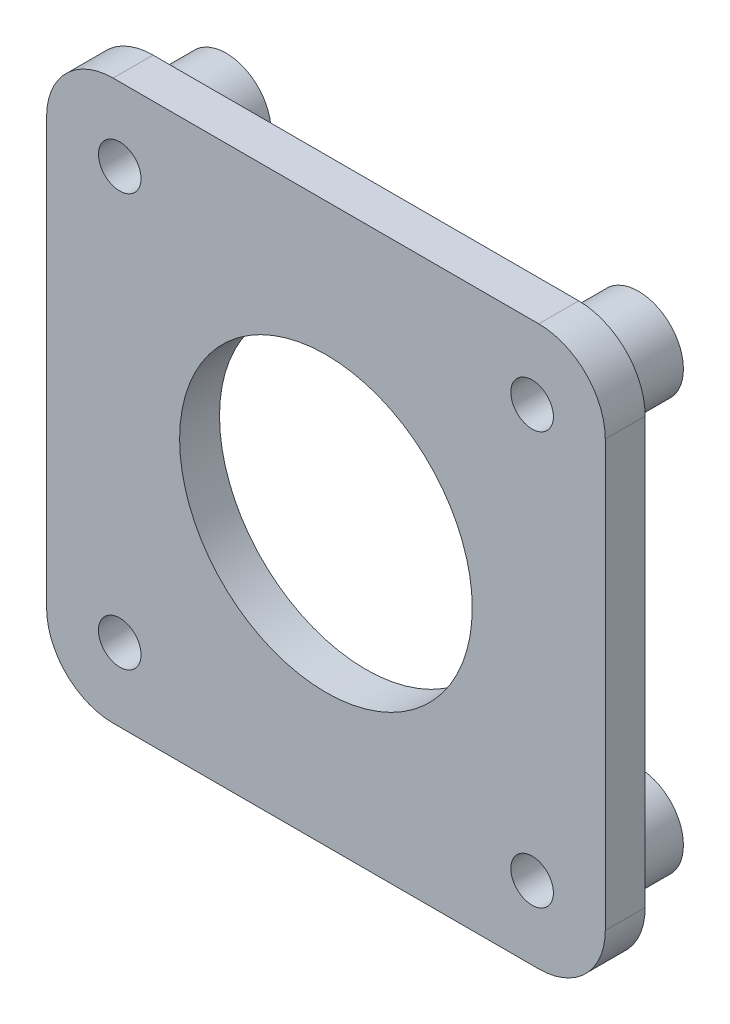
from build123d import *
from build123d.topology import SkipClean

# Parameters (mm, degrees)
SKETCH_1_W          = 42
SKETCH_1_H          = 42
SKETCH_1_R          = 1.6
SKETCH_1_R_2        = 11
EXTRUDE_1_DEPTH     = 3
FILLET_1_R          = 5
SKETCH_2_R          = 18
SKETCH_2_R_2        = 16
EXTRUDE_2_DEPTH     = 7
SKETCH_3_R          = 18
CUT_EXTRUDE_1_DEPTH = 31.512292605
EXTRUDE_START       = 10
SKETCH_5_R          = 3.3744514
SKETCH_5_R_2        = 1.6
EXTRUDE_3_DEPTH     = 10
SKETCH_6_R          = 29.988596493
CUT_EXTRUDE_2_DEPTH = 5


with BuildPart() as part:
    # 草图1 → 凸台-拉伸1 (new body)
    with BuildSketch(Plane.XY):
        Rectangle(SKETCH_1_W, SKETCH_1_H)
        with Locations((-15.5, 15.5)):
            Circle(SKETCH_1_R, mode=Mode.SUBTRACT)
        with Locations((15.5, 15.5)):
            Circle(SKETCH_1_R, mode=Mode.SUBTRACT)
        with Locations((15.5, -15.5)):
            Circle(SKETCH_1_R, mode=Mode.SUBTRACT)
        with Locations((-15.5, -15.5)):
            Circle(SKETCH_1_R, mode=Mode.SUBTRACT)
        Circle(SKETCH_1_R_2, mode=Mode.SUBTRACT)
    extrude(amount=EXTRUDE_1_DEPTH)

    # 圆角1
    fillet_1_edges = [part.edges().sort_by_distance(p)[0] for p in [
        (-21, -21, 1.5),
        (-21, 21, 1.5),
        (21, 21, 1.5),
        (21, -21, 1.5),
    ]]
    fillet(fillet_1_edges, radius=FILLET_1_R)

    # 草图2 → 凸台-拉伸2 (add)
    with BuildSketch(Plane(origin=(0, 0, 0), x_dir=(-1, 0, 0), z_dir=(0, 0, -1))):
        with Locations(Location((0, 0, 0), (0, 0, 180))):
            Circle(SKETCH_2_R)
        Circle(SKETCH_2_R_2, mode=Mode.SUBTRACT)
    extrude(amount=EXTRUDE_2_DEPTH)

    # 草图3 → 切除-拉伸1 (cut, through all)
    with BuildSketch(Plane(origin=(0, 0, 0), x_dir=(-1, 0, 0), z_dir=(0, 0, -1))):
        Circle(SKETCH_3_R)
    extrude(amount=CUT_EXTRUDE_1_DEPTH, mode=Mode.SUBTRACT)

    # 草图5 → 凸台-拉伸3 (add)
    # profile 1 of 4: a face of its own
    with SkipClean():  # the faces are left unmerged after this step: merging them gives an invalid solid
        with BuildSketch(Plane(origin=(0, 0, 0), x_dir=(-1, 0, 0), z_dir=(0, 0, -1)).offset(EXTRUDE_START)):
            with Locations(Location((-15.5, 15.5, 0), (0, 0, 180))):
                Circle(SKETCH_5_R)
            with Locations((-15.5, 15.5)):
                Circle(SKETCH_5_R_2, mode=Mode.SUBTRACT)
        # profile 2 of 4: a face of its own
        with BuildSketch(Plane(origin=(0, 0, 0), x_dir=(-1, 0, 0), z_dir=(0, 0, -1)).offset(EXTRUDE_START)):
            with Locations(Location((15.5, 15.5, 0), (0, 0, 180))):
                Circle(SKETCH_5_R)
            with Locations((15.5, 15.5)):
                Circle(SKETCH_5_R_2, mode=Mode.SUBTRACT)
        # profile 3 of 4: a face of its own
        with BuildSketch(Plane(origin=(0, 0, 0), x_dir=(-1, 0, 0), z_dir=(0, 0, -1)).offset(EXTRUDE_START)):
            with Locations(Location((15.5, -15.5, 0), (0, 0, 180))):
                Circle(SKETCH_5_R)
            with Locations((15.5, -15.5)):
                Circle(SKETCH_5_R_2, mode=Mode.SUBTRACT)
        # profile 4 of 4: a face of its own
        with BuildSketch(Plane(origin=(0, 0, 0), x_dir=(-1, 0, 0), z_dir=(0, 0, -1)).offset(EXTRUDE_START)):
            with Locations(Location((-15.5, -15.5, 0), (0, 0, 180))):
                Circle(SKETCH_5_R)
            with Locations((-15.5, -15.5)):
                Circle(SKETCH_5_R_2, mode=Mode.SUBTRACT)
        extrude(amount=-EXTRUDE_3_DEPTH)

    # 草图6 → 切除-拉伸2 (cut)
    with SkipClean():  # the faces are left unmerged after this step: merging them gives an invalid solid
        with BuildSketch(Plane(origin=(0, 0, -10), x_dir=(-1, 0, 0), z_dir=(0, 0, -1))):
            Circle(SKETCH_6_R)
        extrude(amount=-CUT_EXTRUDE_2_DEPTH, mode=Mode.SUBTRACT)


solid = part.part
